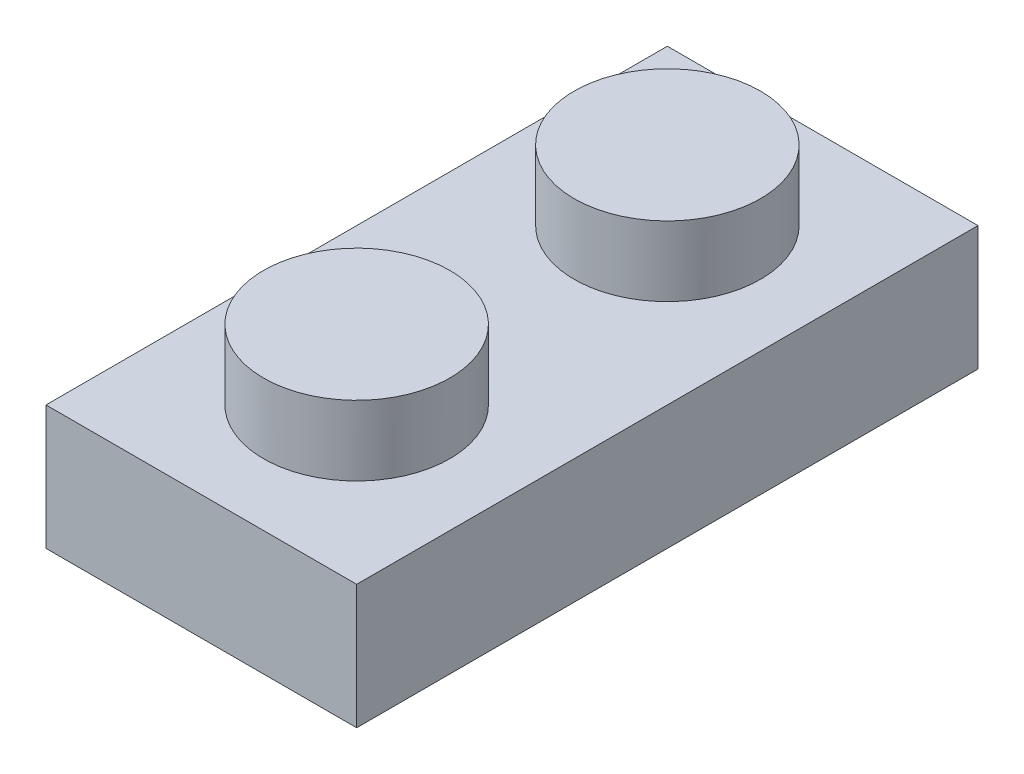
from build123d import *

# Parameters (mm, degrees)
SKETCH1_W           = 8
SKETCH1_H           = 3.2
BOSS_EXTRUDE1_DEPTH = 16
SKETCH2_W           = 4.8
SKETCH2_H           = 12.8
CUT_EXTRUDE1_DEPTH  = 1.8
SKETCH3_R           = 2.4
BOSS_EXTRUDE2_DEPTH = 1.8
SKETCH4_R           = 1.6
BOSS_EXTRUDE3_DEPTH = 1.8
SKETCH5_R           = 0.8
CUT_EXTRUDE2_DEPTH  = 1.8


with BuildPart() as part:
    # Sketch1 → Boss-Extrude1 (new body)
    with BuildSketch(Plane.XY):
        with Locations((4, 1.6)):
            Rectangle(SKETCH1_W, SKETCH1_H)
    extrude(amount=BOSS_EXTRUDE1_DEPTH)

    # Sketch2 → Cut-Extrude1 (cut)
    with BuildSketch(Plane.XZ):
        with Locations((4, 8)):
            Rectangle(SKETCH2_W, SKETCH2_H)
    extrude(amount=-CUT_EXTRUDE1_DEPTH, mode=Mode.SUBTRACT)

    # Sketch3 → Boss-Extrude2 (add)
    with BuildSketch(Plane(origin=(0, 3.2, 0), x_dir=(1, 0, 0), z_dir=(0, 1, 0))):
        with Locations((4, -4)):
            Circle(SKETCH3_R)
        with Locations((4, -12)):
            Circle(SKETCH3_R)
    extrude(amount=BOSS_EXTRUDE2_DEPTH)

    # Sketch4 → Boss-Extrude3 (add)
    with BuildSketch(Plane.XZ.offset(-1.8)):
        with Locations((4, 8)):
            Circle(SKETCH4_R)
    extrude(amount=BOSS_EXTRUDE3_DEPTH)

    # Sketch5 → Cut-Extrude2 (cut)
    with BuildSketch(Plane.XZ):
        with Locations((4, 8)):
            Circle(SKETCH5_R)
    extrude(amount=-CUT_EXTRUDE2_DEPTH, mode=Mode.SUBTRACT)


solid = part.part
